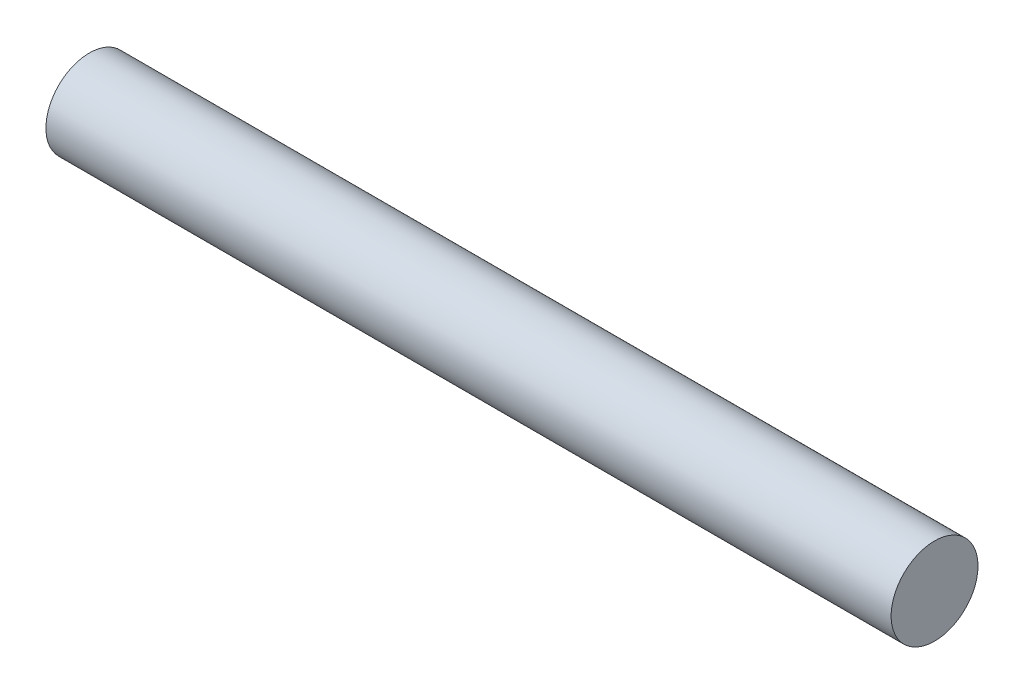
from build123d import *

# Parameters (mm, degrees)
SKETCH1_R           = 0.925
BOSS_EXTRUDE1_DEPTH = 18


with BuildPart() as part:
    # Sketch1 → Boss-Extrude1 (new body)
    with BuildSketch(Plane(origin=(0, 0, 0), x_dir=(0, 0, -1), z_dir=(1, 0, 0))):
        Circle(SKETCH1_R)
    extrude(amount=BOSS_EXTRUDE1_DEPTH)


solid = part.part
